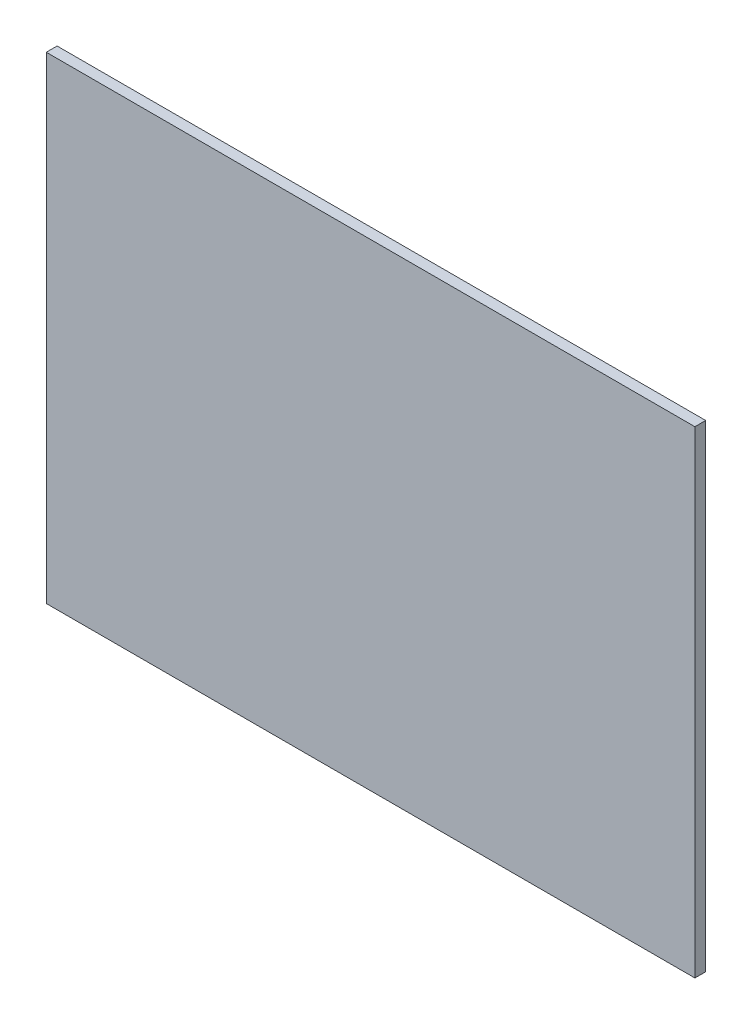
from build123d import *

# Parameters (mm, degrees)
SKETCH1_W           = 180
SKETCH1_H           = 132.5
BOSS_EXTRUDE1_DEPTH = 3


with BuildPart() as part:
    # Sketch1 → Boss-Extrude1 (new body)
    with BuildSketch(Plane.XY):
        Rectangle(SKETCH1_W, SKETCH1_H)
    extrude(amount=BOSS_EXTRUDE1_DEPTH)


solid = part.part
